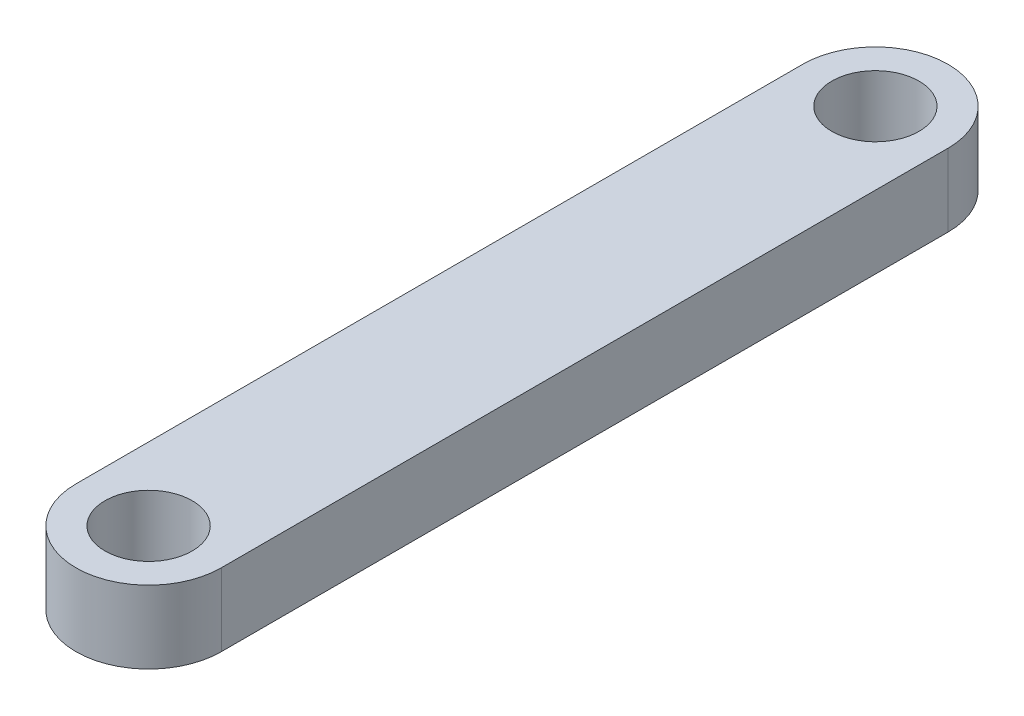
from build123d import *

# Parameters (mm, degrees)
SKETCH1_R           = 6
BOSS_EXTRUDE1_DEPTH = 10


with BuildPart() as part:
    # Sketch1 → Boss-Extrude1 (new body)
    with BuildSketch(Plane(origin=(0, 0, 0), x_dir=(1, 0, 0), z_dir=(0, 1, 0))):
        with BuildLine():
            Line((10, 0), (10, 100))
            ThreePointArc((10, 100), (0, 110), (-10, 100))
            Line((-10, 100), (-10, 0))
            ThreePointArc((-10, 0), (0, -10), (10, 0))
        make_face()
        with Locations(Location((0, 100, 0), (0, 0, 270))):
            Circle(SKETCH1_R, mode=Mode.SUBTRACT)
        with Locations(Location((0, 0, 0), (0, 0, 270))):
            Circle(SKETCH1_R, mode=Mode.SUBTRACT)
    extrude(amount=BOSS_EXTRUDE1_DEPTH)


solid = part.part
